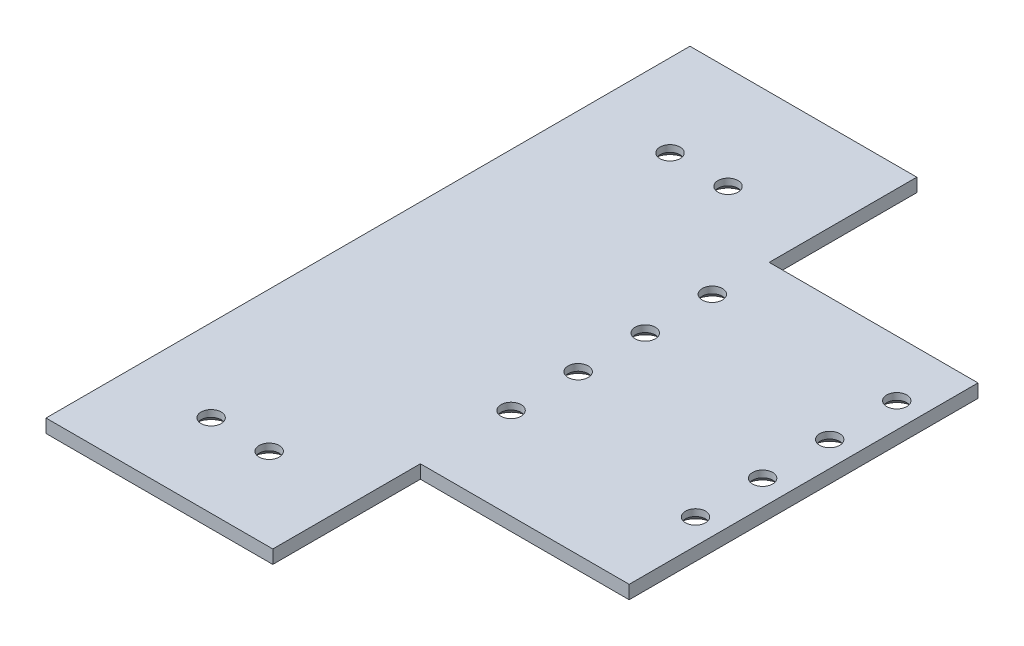
from build123d import *

# Parameters (mm, degrees)
SKETCH_1_W          = 17.893001423
SKETCH_1_H          = 11.620982588
SKETCH_1_H_2        = 11.620982589
EXTRUDE_1_DEPTH     = 2
SKETCH_2_R          = 1.5
CUT_EXTRUDE_1_DEPTH = 10
CHAMFER_1_SIZE      = 1
SKETCH_3_R          = 1.5
CUT_EXTRUDE_2_DEPTH = 10
SKETCH_4_W          = 33.95700602
SKETCH_4_H          = 96
CUT_EXTRUDE_3_DEPTH = 10
CHAMFER_2_SIZE      = 1


with BuildPart() as part:
    # Эскиз1 → Бобышка-Вытянуть1 (new body)
    with BuildSketch(Plane(origin=(0, 0, 0), x_dir=(1, 0, 0), z_dir=(0, 1, 0))):
        Polygon((49.933797981, 26), (18.809932441, 26), (18.809932441, 48), (15, 48), (-48.959081244, 48), (-48.959081244, -48), (15, -48), (18.809932441, -48), (18.809932441, -26), (49.933797981, -26), align=None)
        with Locations((-36.319088007, -31.12001489)):
            Rectangle(SKETCH_1_W, SKETCH_1_H, mode=Mode.SUBTRACT)
        with Locations((-36.319088007, 31.12001489)):
            Rectangle(SKETCH_1_W, SKETCH_1_H_2, mode=Mode.SUBTRACT)
    extrude(amount=EXTRUDE_1_DEPTH)

    # Эскиз2 → Вырез-Вытянуть1 (cut)
    with BuildSketch(Plane(origin=(0, 2, 0), x_dir=(1, 0, 0), z_dir=(0, 1, 0))):
        with Locations(Location((46.183797981, -12.357312676, 0), (0, 0, 270))):
            Circle(SKETCH_2_R)
        with Locations(Location((18.683797981, -12.357312676, 0), (0, 0, 270))):
            Circle(SKETCH_2_R)
        with Locations(Location((18.683797981, -2.357312676, 0), (0, 0, 270))):
            Circle(SKETCH_2_R)
        with Locations(Location((46.183797981, -2.357312676, 0), (0, 0, 270))):
            Circle(SKETCH_2_R)
        with Locations(Location((18.683797981, 7.642687324, 0), (0, 0, 270))):
            Circle(SKETCH_2_R)
        with Locations(Location((46.183797981, 7.642687324, 0), (0, 0, 270))):
            Circle(SKETCH_2_R)
        with Locations(Location((18.683797981, 17.642687324, 0), (0, 0, 270))):
            Circle(SKETCH_2_R)
        with Locations(Location((46.183797981, 17.642687324, 0), (0, 0, 270))):
            Circle(SKETCH_2_R)
    extrude(amount=-CUT_EXTRUDE_1_DEPTH, mode=Mode.SUBTRACT)

    # Фаска1
    chamfer_1_edges = [part.edges().sort_by_distance(p)[0] for p in [
        (46.183797981, 0, -9.142687324),
        (18.683797981, 0, 0.857312676),
        (46.183797981, 0, 0.857312676),
        (18.683797981, 0, 10.857312676),
        (18.683797981, 0, -19.142687324),
        (46.183797981, 0, -19.142687324),
        (18.683797981, 0, -9.142687324),
        (46.183797981, 0, 10.857312676),
    ]]
    chamfer(chamfer_1_edges, length=CHAMFER_1_SIZE)

    # Эскиз3 → Вырез-Вытянуть2 (cut)
    with BuildSketch(Plane(origin=(0, 2, 0), x_dir=(1, 0, 0), z_dir=(0, 1, 0))):
        with Locations(Location((5.923569009, 32.746976788, 0), (0, 0, 270))):
            Circle(SKETCH_3_R)
        with Locations(Location((-2.726430991, 32.746976788, 0), (0, 0, 270))):
            Circle(SKETCH_3_R)
        with Locations(Location((-2.726430991, -35.660220789, 0), (0, 0, 270))):
            Circle(SKETCH_3_R)
        with Locations(Location((5.923569009, -35.660220789, 0), (0, 0, 270))):
            Circle(SKETCH_3_R)
    extrude(amount=-CUT_EXTRUDE_2_DEPTH, mode=Mode.SUBTRACT)

    # Эскиз4 → Вырез-Вытянуть3 (cut)
    with BuildSketch(Plane(origin=(0, 2, 0), x_dir=(1, 0, 0), z_dir=(0, 1, 0))):
        with Locations((-31.980578234, 0)):
            Rectangle(SKETCH_4_W, SKETCH_4_H)
    extrude(amount=-CUT_EXTRUDE_3_DEPTH, mode=Mode.SUBTRACT)

    # Фаска2
    chamfer_2_edges = [part.edges().sort_by_distance(p)[0] for p in [
        (5.923569009, 0, 34.160220789),
        (-2.726430991, 0, 34.160220789),
        (-2.726430991, 0, -34.246976788),
        (5.923569009, 0, -34.246976788),
    ]]
    chamfer(chamfer_2_edges, length=CHAMFER_2_SIZE)


solid = part.part
